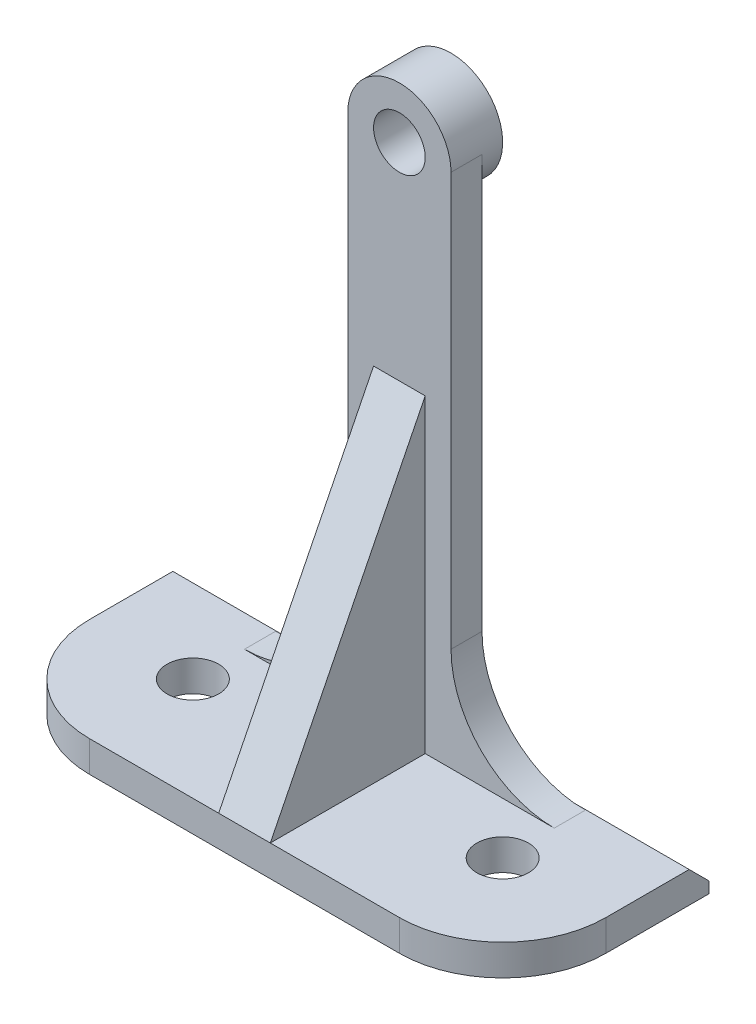
from build123d import *

# Parameters (mm, degrees)
SKETCH1_R           = 6.35
BOSS_EXTRUDE1_DEPTH = 7.62
BOSS_EXTRUDE2_START = -5.08
SKETCH4_R           = 6.35
BOSS_EXTRUDE2_DEPTH = 7.62
BOSS_EXTRUDE3_START = 0
SKETCH4_3_R         = 6.35
BOSS_EXTRUDE3_DEPTH = 5.08
FILLET1_R           = 25.4
RIB1_REACH          = 164.421
SKETCH5_WALL_W      = 412.036258646
SKETCH5_WALL_H      = 12.7
CHAMFER1_SIZE       = 4.92


with BuildPart() as part:
    # Sketch1 → Boss-Extrude1 (new body)
    with BuildSketch(Plane(origin=(0, 0, 0), x_dir=(1, 0, 0), z_dir=(0, 1, 0))):
        with BuildLine():
            Line((-63.5, 25.4), (63.5, 25.4))
            Line((63.5, 25.4), (63.5, 0))
            ThreePointArc((63.5, 0), (56.060512242, -17.960512242), (38.1, -25.4))
            Line((38.1, -25.4), (-38.1, -25.4))
            ThreePointArc((-38.1, -25.4), (-56.060512242, -17.960512242), (-63.5, 0))
            Line((-63.5, 0), (-63.5, 25.4))
        make_face()
        with Locations((-38.1, 0)):
            Circle(SKETCH1_R, mode=Mode.SUBTRACT)
        with Locations((38.1, 0)):
            Circle(SKETCH1_R, mode=Mode.SUBTRACT)
    extrude(amount=BOSS_EXTRUDE1_DEPTH)

    # Sketch4 → Boss-Extrude2 (add)
    with BuildSketch(Plane(origin=(0, 0, -25.4), x_dir=(-1, 0, 0), z_dir=(0, 0, -1)).offset(BOSS_EXTRUDE2_START)):
        with BuildLine():
            ThreePointArc((12.7, 134.62), (0, 147.32), (-12.7, 134.62))
            Line((-12.7, 134.62), (-12.7, 7.62))
            Line((-12.7, 7.62), (12.7, 7.62))
            Line((12.7, 7.62), (12.7, 134.62))
        make_face()
        with Locations((0, 134.62)):
            Circle(SKETCH4_R, mode=Mode.SUBTRACT)
    extrude(amount=-BOSS_EXTRUDE2_DEPTH)

    # Sketch4<3> → Boss-Extrude3 (add)
    with BuildSketch(Plane(origin=(0, 0, -25.4), x_dir=(-1, 0, 0), z_dir=(0, 0, -1)).offset(BOSS_EXTRUDE3_START)):
        with BuildLine():
            ThreePointArc((-12.7, 134.62), (0, 121.92), (12.7, 134.62))
            ThreePointArc((12.7, 134.62), (0, 147.32), (-12.7, 134.62))
        make_face()
        with Locations((0, 134.62)):
            Circle(SKETCH4_3_R, mode=Mode.SUBTRACT)
    extrude(amount=-BOSS_EXTRUDE3_DEPTH)

    # Fillet1
    fillet1_edges = [part.edges().sort_by_distance(p)[0] for p in [
        (-12.7, 7.62, -16.51),
        (12.7, 7.62, -16.51),
    ]]
    fillet(fillet1_edges, radius=FILLET1_R)

    # Sketch5 wall → Rib1 (add, up to next)
    with BuildSketch(Plane(origin=(0, 45.72, 6.35), x_dir=(0, 0.894427191, -0.4472135955), z_dir=(0, 0.4472135955, 0.894427191)), mode=Mode.PRIVATE) as rib1_sk1:
        Rectangle(SKETCH5_WALL_W, SKETCH5_WALL_H)
    rib1_tool1 = extrude(rib1_sk1.sketch, amount=-RIB1_REACH, mode=Mode.PRIVATE) - part.part
    add(rib1_tool1.solids().sort_by_distance((0, 45.72, 6.35))[0])

    # Chamfer1
    chamfer1_edges = [part.edges().sort_by_distance(p)[0] for p in [
        (0, 7.62, -25.4),
    ]]
    chamfer(chamfer1_edges, length=CHAMFER1_SIZE)


solid = part.part
